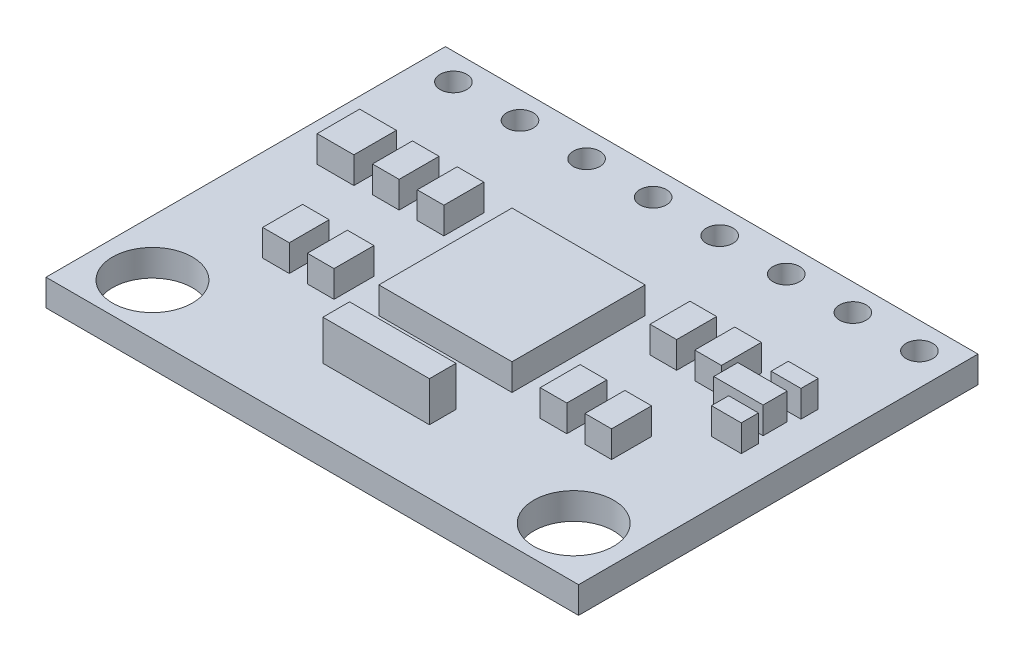
from build123d import *

# Parameters (mm, degrees)
SKETCH1_W           = 20
SKETCH1_H           = 15
BOSS_EXTRUDE1_DEPTH = 1
SKETCH2_R           = 0.5
CUT_EXTRUDE1_DEPTH  = 1
SKETCH3_R           = 1.5
CUT_EXTRUDE2_DEPTH  = 1
SKETCH4_W           = 5
SKETCH4_H           = 5
BOSS_EXTRUDE2_DEPTH = 1
SKETCH5_W           = 4
SKETCH5_H           = 1
BOSS_EXTRUDE3_DEPTH = 1.5
SKETCH6_W           = 1
SKETCH6_H           = 1.5
BOSS_EXTRUDE4_DEPTH = 1
SKETCH7_W           = 1.379354472
SKETCH7_H           = 1.594878607
SKETCH7_W_2         = 1.853507571
SKETCH7_H_2         = 0.905201372
SKETCH7_W_3         = 1.120725508
SKETCH7_H_3         = 0.646572409
BOSS_EXTRUDE5_DEPTH = 1


with BuildPart() as part:
    # Sketch1 → Boss-Extrude1 (new body)
    with BuildSketch(Plane(origin=(0, 0, 0), x_dir=(1, 0, 0), z_dir=(0, 1, 0))):
        Rectangle(SKETCH1_W, SKETCH1_H)
    extrude(amount=BOSS_EXTRUDE1_DEPTH)

    # Sketch2 → Cut-Extrude1 (cut)
    with BuildSketch(Plane(origin=(0, 1, 0), x_dir=(1, 0, 0), z_dir=(0, 1, 0))):
        with Locations(Location((8.8, 6.5, 0), (0, 0, 270))):
            Circle(SKETCH2_R)
        with Locations(Location((6.3, 6.5, 0), (0, 0, 270))):
            Circle(SKETCH2_R)
        with Locations(Location((3.8, 6.5, 0), (0, 0, 270))):
            Circle(SKETCH2_R)
        with Locations(Location((1.3, 6.5, 0), (0, 0, 270))):
            Circle(SKETCH2_R)
        with Locations(Location((-1.2, 6.5, 0), (0, 0, 270))):
            Circle(SKETCH2_R)
        with Locations(Location((-3.7, 6.5, 0), (0, 0, 270))):
            Circle(SKETCH2_R)
        with Locations(Location((-6.2, 6.5, 0), (0, 0, 270))):
            Circle(SKETCH2_R)
        with Locations(Location((-8.7, 6.5, 0), (0, 0, 270))):
            Circle(SKETCH2_R)
    extrude(amount=-CUT_EXTRUDE1_DEPTH, mode=Mode.SUBTRACT)

    # Sketch3 → Cut-Extrude2 (cut)
    with BuildSketch(Plane(origin=(0, 1, 0), x_dir=(1, 0, 0), z_dir=(0, 1, 0))):
        with Locations(Location((7.909735798, -5.592851334, 0), (0, 0, 270))):
            Circle(SKETCH3_R)
        with Locations(Location((-7.909735798, -5.592851334, 0), (0, 0, 90))):
            Circle(SKETCH3_R)
    extrude(amount=-CUT_EXTRUDE2_DEPTH, mode=Mode.SUBTRACT)

    # Sketch4 → Boss-Extrude2 (add)
    with BuildSketch(Plane(origin=(0, 1, 0), x_dir=(1, 0, 0), z_dir=(0, 1, 0))):
        Rectangle(SKETCH4_W, SKETCH4_H)
    extrude(amount=BOSS_EXTRUDE2_DEPTH)

    # Sketch5 → Boss-Extrude3 (add)
    with BuildSketch(Plane(origin=(0, 1, 0), x_dir=(1, 0, 0), z_dir=(0, 1, 0))):
        with Locations((0, -4.601440307)):
            Rectangle(SKETCH5_W, SKETCH5_H)
    extrude(amount=BOSS_EXTRUDE3_DEPTH)

    # Sketch6 → Boss-Extrude4 (add)
    with BuildSketch(Plane(origin=(0, 1, 0), x_dir=(1, 0, 0), z_dir=(0, 1, 0))):
        with Locations((-6.05193374, 2.062589977)):
            Rectangle(SKETCH6_W, SKETCH6_H)
        with Locations((-4.370845478, 2.062589977)):
            Rectangle(SKETCH6_W, SKETCH6_H)
        with Locations((-6.05193374, -2.062589977)):
            Rectangle(SKETCH6_W, SKETCH6_H)
        with Locations((-4.370845478, -2.062589977)):
            Rectangle(SKETCH6_W, SKETCH6_H)
        with Locations((4.370845478, -2.062589977)):
            Rectangle(SKETCH6_W, SKETCH6_H)
        with Locations((6.05193374, -2.062589977)):
            Rectangle(SKETCH6_W, SKETCH6_H)
        with Locations((4.370845478, 2.062589977)):
            Rectangle(SKETCH6_W, SKETCH6_H)
        with Locations((6.05193374, 2.062589977)):
            Rectangle(SKETCH6_W, SKETCH6_H)
    extrude(amount=BOSS_EXTRUDE4_DEPTH)

    # Sketch7 → Boss-Extrude5 (add)
    with BuildSketch(Plane(origin=(0, 1, 0), x_dir=(1, 0, 0), z_dir=(0, 1, 0))):
        with Locations((-7.888183384, 2.058255501)):
            Rectangle(SKETCH7_W, SKETCH7_H)
        with Locations((7.694211662, 1.260816197)):
            Rectangle(SKETCH7_W_2, SKETCH7_H_2)
        with Locations((8.233022002, 2.381541705)):
            Rectangle(SKETCH7_W_3, SKETCH7_H_3)
        with Locations((8.233022002, 0.140090689)):
            Rectangle(SKETCH7_W_3, SKETCH7_H_3)
    extrude(amount=BOSS_EXTRUDE5_DEPTH)


solid = part.part
